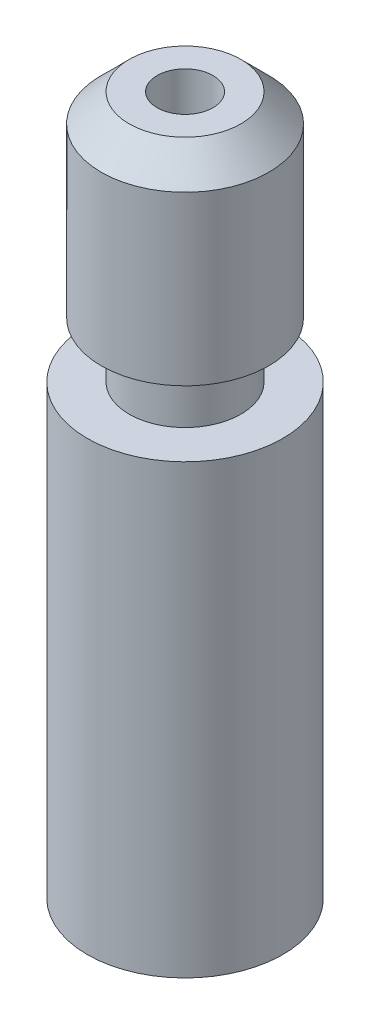
from build123d import *

# Parameters (mm, degrees)
SKETCH_1_R          = 3.5
EXTRUDE_1_DEPTH     = 16
SKETCH_2_R          = 2
EXTRUDE_2_DEPTH     = 25
SKETCH_3_R          = 3
EXTRUDE_3_DEPTH     = 7
CHAMFER_1_SIZE      = 1
SKETCH_4_R          = 1
CUT_EXTRUDE_1_DEPTH = 26.485289875
SKETCH_5_R          = 2
CUT_EXTRUDE_2_DEPTH = 2


with BuildPart() as part:
    # 草圖1 → 填料-伸長1 (new body)
    with BuildSketch(Plane(origin=(0, 0, 0), x_dir=(1, 0, 0), z_dir=(0, 1, 0))):
        with Locations(Location((0, 0, 0), (0, 0, 270))):
            Circle(SKETCH_1_R)
    extrude(amount=EXTRUDE_1_DEPTH)

    # 草圖2 → 填料-伸長2 (add)
    with BuildSketch(Plane(origin=(0, 0, 0), x_dir=(1, 0, 0), z_dir=(0, 1, 0))):
        with Locations(Location((0, 0, 0), (0, 0, 270))):
            Circle(SKETCH_2_R)
    extrude(amount=EXTRUDE_2_DEPTH)

    # 草圖3 → 填料-伸長3 (add)
    with BuildSketch(Plane(origin=(0, 25, 0), x_dir=(1, 0, 0), z_dir=(0, 1, 0))):
        with Locations(Location((0, 0, 0), (0, 0, 270))):
            Circle(SKETCH_3_R)
    extrude(amount=-EXTRUDE_3_DEPTH)

    # 導角1
    chamfer_1_edges = [part.edges().sort_by_distance(p)[0] for p in [
        (0, 25, -3),
    ]]
    chamfer(chamfer_1_edges, length=CHAMFER_1_SIZE)

    # 草圖4 → 除料-伸長1 (cut, through all)
    with BuildSketch(Plane(origin=(0, 25, 0), x_dir=(1, 0, 0), z_dir=(0, 1, 0))):
        with Locations(Location((0, 0, 0), (0, 0, 270))):
            Circle(SKETCH_4_R)
    extrude(amount=-CUT_EXTRUDE_1_DEPTH, mode=Mode.SUBTRACT)

    # 草圖5 → 除料-伸長2 (cut)
    with BuildSketch(Plane(origin=(0, 0, 0), x_dir=(-1, 0, 0), z_dir=(0, -1, 0))):
        with Locations(Location((0, 0, 0), (0, 0, 270))):
            Circle(SKETCH_5_R)
    extrude(amount=-CUT_EXTRUDE_2_DEPTH, mode=Mode.SUBTRACT)


solid = part.part
